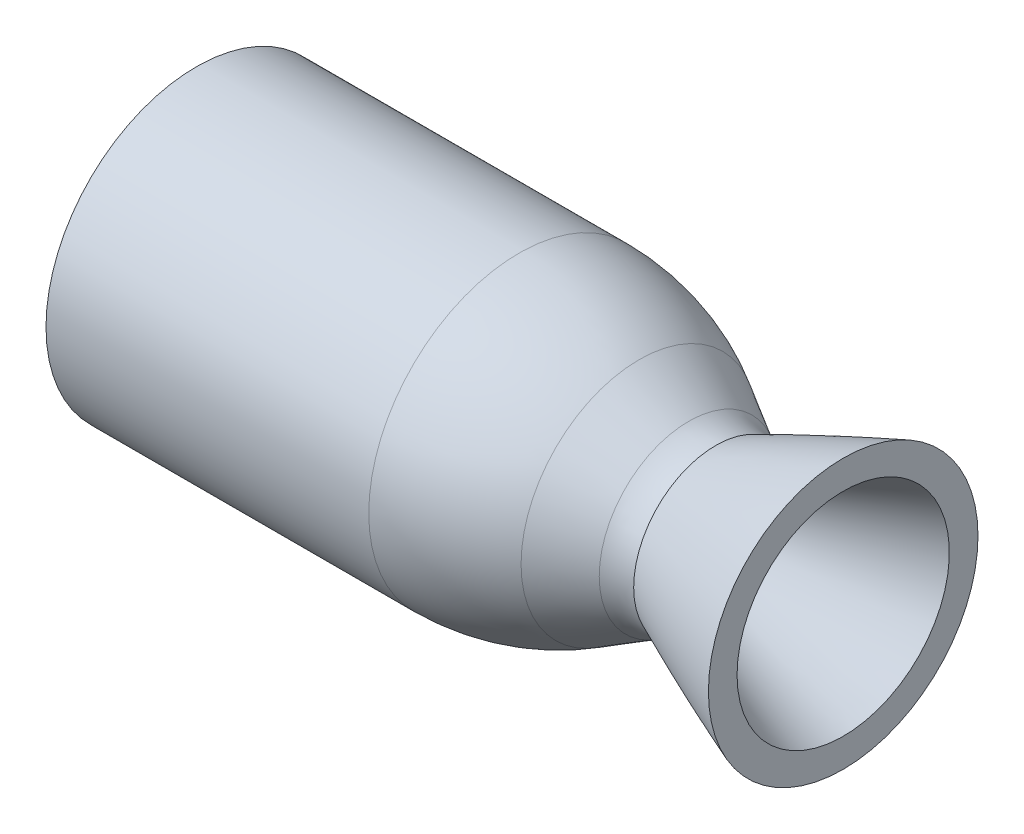
from build123d import *

# Parameters (mm, degrees)
CUT_EXTRUDE1_DEPTH      = 391.541482324
CUT_EXTRUDE1_DEPTH_BACK = 391.541482324
SKETCH6_W               = 140
SKETCH6_H               = 298.689117204


with BuildPart() as part:
    # Sketch1 → Revolve1 (revolve)
    with BuildSketch(Plane.XY, mode=Mode.PRIVATE) as revolve1_sk:
        with BuildLine():
            Line((192.877031349, 42.655012217), (215.127149697, 29.808876046))
            ThreePointArc((215.127149697, 29.808876046), (224.106622413, 26.089455548), (233.742783423, 24.820826336))
            ThreePointArc((233.742783423, 24.820826336), (235.713203517, 25.027826984), (237.597587303, 25.639792966))
            add(Edge.make_bspline(
                [(237.597587303, 25.639792966), (305.794911856, 55.987196879), (370.436287167, 74.957098261)],
                knots=[0, 0, 0, 1, 1, 1], degree=2))
            Line((370.436287167, 74.957098261), (370.436287167, 87.463153647))
            Line((370.436287167, 87.463153647), (367.057221516, 86.471520319))
            add(Edge.make_bspline(
                [(233.22019623, 36.826239285), (236.069082049, 38.09248657), (241.789514517, 40.609481325), (253.162518773, 45.510982188), (267.324585603, 51.421835133), (284.209562024, 58.15884205), (300.991410001, 64.542388321), (317.668219236, 70.571409981), (334.241993713, 76.246293785), (347.963085648, 80.678672393), (358.895885037, 84.049397838), (364.330437681, 85.671308068), (367.057221516, 86.471520319)],
                knots=[0.492865274, 0.492865274, 0.492865274, 0.492865274, 0.492972774, 0.493080274, 0.493295274, 0.493510274, 0.493725274, 0.493940275, 0.494155275, 0.494370275, 0.494477775, 0.494585275, 0.494585275, 0.494585275, 0.494585275], degree=3))
            ThreePointArc((233.22019623, 36.826239285), (226.960399594, 37.749503395), (221.127153585, 40.201178647))
            Line((221.127153585, 40.201178647), (198.877039879, 53.047312137))
            ThreePointArc((198.877039879, 53.047312137), (172.857293904, 63.825067551), (144.9346606, 67.5011717))
            Line((144.9346606, 67.5011717), (0, 67.5011717))
            Line((0, 67.5011717), (0, 55.5011717))
            Line((0, 55.5011717), (144.9346606, 55.5011717))
            ThreePointArc((144.9346606, 55.5011717), (169.751460606, 52.23395891), (192.877031349, 42.655012217))
        make_face()
    revolve(revolve1_sk.sketch.rotate(Axis((0, 0, 0), (1, 0, 0)), 90), axis=Axis((0, 0, 0), (1, 0, 0)))

    # Sketch6 → Cut-Extrude1 (cut, two sides: drawn at the far end of the back side and taken through both)
    with BuildSketch(Plane.XY.offset(-CUT_EXTRUDE1_DEPTH_BACK)):
        with Locations((360.486, 0)):
            Rectangle(SKETCH6_W, SKETCH6_H)
    extrude(amount=CUT_EXTRUDE1_DEPTH + CUT_EXTRUDE1_DEPTH_BACK, mode=Mode.SUBTRACT)


solid = part.part
